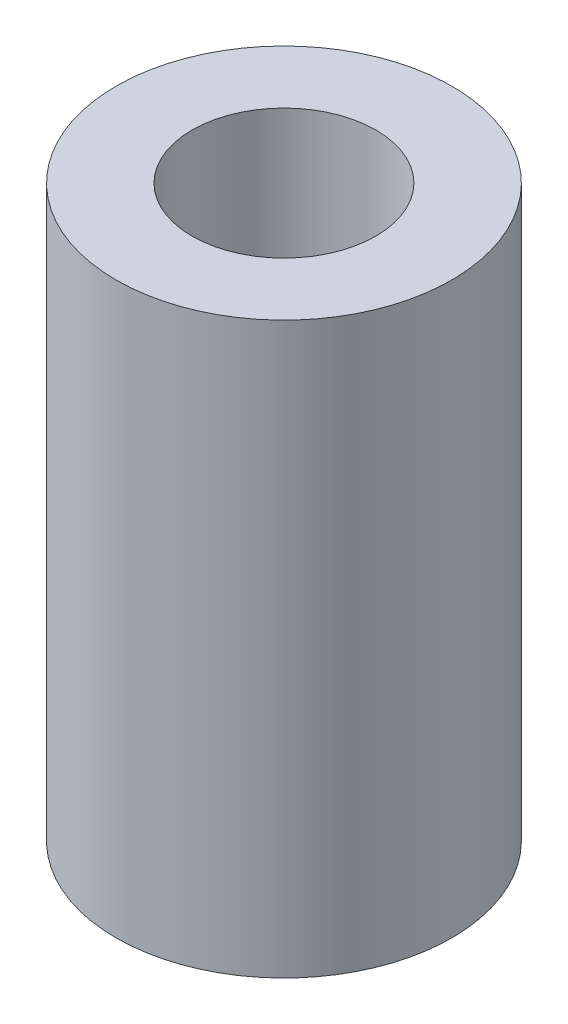
from build123d import *

# Parameters (mm, degrees)
SKETCH1_R           = 44.2
SKETCH1_R_2         = 24.2
BOSS_EXTRUDE1_DEPTH = 75


with BuildPart() as part:
    # Sketch1 → Boss-Extrude1 (new, symmetric)
    with BuildSketch(Plane(origin=(0, 0, 0), x_dir=(1, 0, 0), z_dir=(0, 1, 0))):
        with Locations(Location((0, 0, 0), (0, 0, 270))):
            Circle(SKETCH1_R)
        with Locations(Location((0, 0, 0), (0, 0, 270))):
            Circle(SKETCH1_R_2, mode=Mode.SUBTRACT)
    extrude(amount=BOSS_EXTRUDE1_DEPTH, both=True)


solid = part.part
